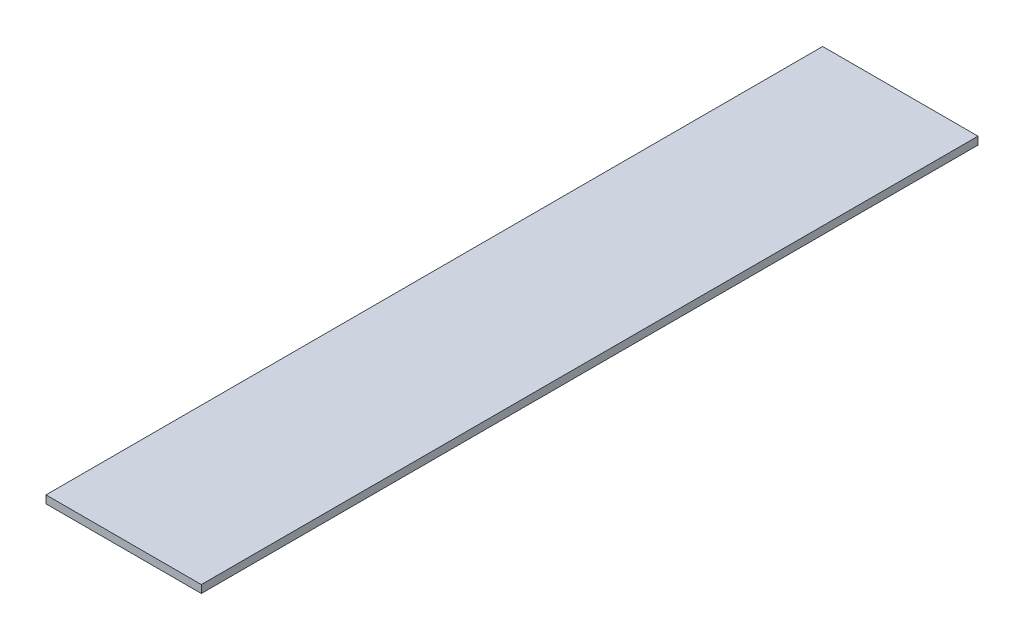
from build123d import *

# Parameters (mm, degrees)
SKETCH_2_W      = 200
SKETCH_2_H      = 10
EXTRUDE_1_DEPTH = 1000


with BuildPart() as part:
    # 草图2 → 凸台-拉伸1 (new body)
    with BuildSketch(Plane.XY):
        with Locations((100, -5)):
            Rectangle(SKETCH_2_W, SKETCH_2_H)
    extrude(amount=EXTRUDE_1_DEPTH)


solid = part.part
